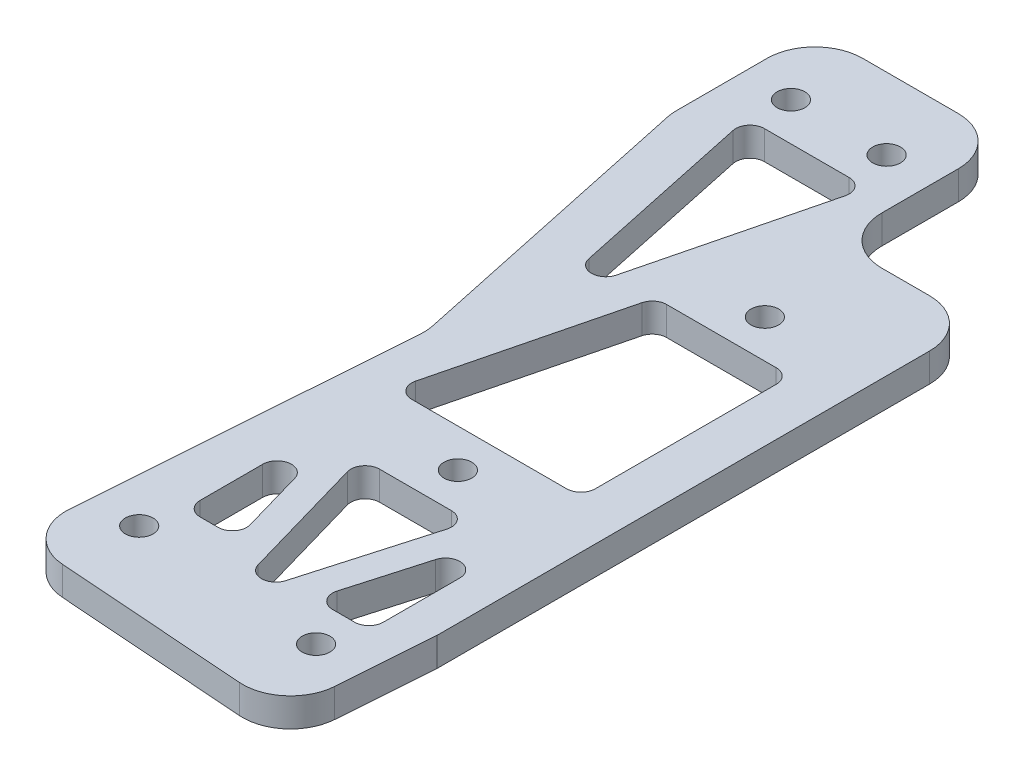
from build123d import *

# Parameters (mm, degrees)
SKETCH_1_R          = 1.45
EXTRUDE_1_DEPTH     = 3
FILLET_1_R          = 5
CUT_EXTRUDE_1_DEPTH = 685.034246793
FILLET_2_R          = 1.5


with BuildPart() as part:
    # 草图1 → 凸台-拉伸1 (new body)
    with BuildSketch(Plane(origin=(0, 0, 0), x_dir=(1, 0, 0), z_dir=(0, 1, 0))):
        Polygon((650.079202112, -57.331500941), (648.989953088, -72.291899885), (678.910750976, -74.470397934), (680, -59.50999899), (680, -3), (665, -3), (665, 15), (645, 15), (645, 0), (651.894617153, -32.397502701), align=None)
        with Locations(Location((660, 7.5, 0), (0, 0, 270))):
            Circle(SKETCH_1_R, mode=Mode.SUBTRACT)
        with Locations(Location((650, 7.5, 0), (0, 0, 270))):
            Circle(SKETCH_1_R, mode=Mode.SUBTRACT)
        with Locations(Location((654.521377248, -65.174783421, 0), (0, 0, 270))):
            Circle(SKETCH_1_R, mode=Mode.SUBTRACT)
        with Locations(Location((674.46857584, -66.627115454, 0), (0, 0, 270))):
            Circle(SKETCH_1_R, mode=Mode.SUBTRACT)
        with Locations(Location((666.12885008, -43.460351022, 0), (0, 0, 270))):
            Circle(SKETCH_1_R, mode=Mode.SUBTRACT)
        with Locations(Location((668.307348129, -13.539553134, 0), (0, 0, 270))):
            Circle(SKETCH_1_R, mode=Mode.SUBTRACT)
    extrude(amount=EXTRUDE_1_DEPTH)

    # 圆角1
    fillet_1_edges = [part.edges().sort_by_distance(p)[0] for p in [
        (678.910750976, 1.5, 74.470397934),
        (648.989953088, 1.5, 72.291899885),
        (651.894617153, 1.5, 32.397502701),
        (645, 1.5, 0),
        (645, 1.5, -15),
        (665, 1.5, -15),
        (665, 1.5, 3),
        (680, 1.5, 3),
    ]]
    fillet(fillet_1_edges, radius=FILLET_1_R)

    # 草图2 → 切除-拉伸1 (cut, through all)
    with BuildSketch(Plane(origin=(0, 3, 0), x_dir=(1, 0, 0), z_dir=(0, 1, 0))):
        Polygon((649.367123648, 3.5), (655.178416972, -23.807011685), (662, 3.5), align=None)
        Polygon((660.867017044, -17.539553134), (675, -17.539553134), (675, -39.460351022), (655.390967722, -39.460351022), align=None)
        Polygon((659.946903123, -47.460351022), (671.444064599, -47.460351022), (665.695483861, -67.49232755), align=None)
        Polygon((655.390967722, -42.460351022), (655.390967722, -61.174783421), (660.76145253, -61.174783421), align=None)
        Polygon((676, -42.460351022), (670.212739147, -62.627115454), (676, -62.627115454), align=None)
    extrude(amount=-CUT_EXTRUDE_1_DEPTH, mode=Mode.SUBTRACT)

    # 圆角2
    fillet_2_edges = [part.edges().sort_by_distance(p)[0] for p in [
        (655.390967722, 1.5, 39.460351022),
        (660.867017044, 1.5, 17.539553134),
        (675, 1.5, 17.539553134),
        (675, 1.5, 39.460351022),
        (665.695483861, 1.5, 67.49232755),
        (659.946903123, 1.5, 47.460351022),
        (671.444064599, 1.5, 47.460351022),
        (676, 1.5, 42.460351022),
        (676, 1.5, 62.627115454),
        (670.212739147, 1.5, 62.627115454),
        (655.390967722, 1.5, 42.460351022),
        (660.76145253, 1.5, 61.174783421),
        (655.390967722, 1.5, 61.174783421),
        (649.367123648, 1.5, -3.5),
        (662, 1.5, -3.5),
        (655.178416972, 1.5, 23.807011685),
        (680, 1.5, 59.50999899),
    ]]
    fillet(fillet_2_edges, radius=FILLET_2_R)


solid = part.part
